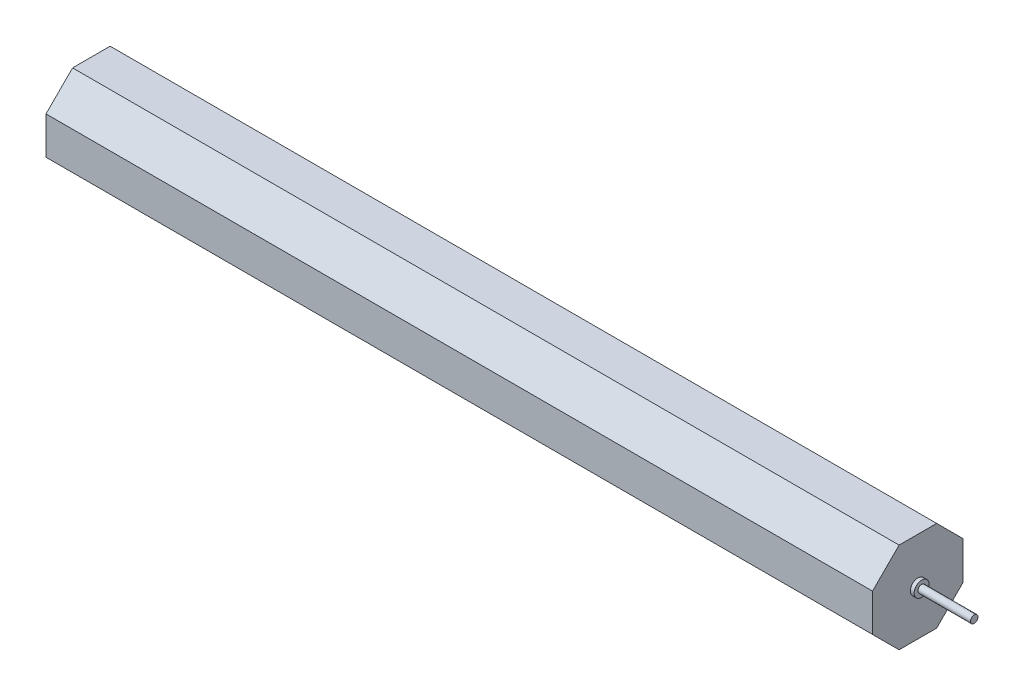
from build123d import *

# Parameters (mm, degrees)
EXTRUDE_1_DEPTH = 220
SKETCH_4_R      = 1
EXTRUDE_2_DEPTH = 15
SKETCH_5_R      = 2
EXTRUDE_3_DEPTH = 1
EXTRUDE_START   = 5
SKETCH_6_R      = 1
EXTRUDE_4_DEPTH = 5
EXTRUDE_START_2 = 1
SKETCH_7_R      = 2
EXTRUDE_5_DEPTH = 1


with BuildPart() as part:
    # 草图1 → 凸台-拉伸1 (new body)
    with BuildSketch(Plane(origin=(0, 0, 0), x_dir=(0, 0, -1), z_dir=(1, 0, 0))):
        Polygon((12.071067812, -5), (12.071067812, 5), (5, 12.071067812), (-5, 12.071067812), (-12.071067812, 5), (-12.071067812, -5), (-5, -12.071067812), (5, -12.071067812), align=None)
    extrude(amount=EXTRUDE_1_DEPTH)

    # 草图4 → 凸台-拉伸2 (add)
    with BuildSketch(Plane(origin=(220, 0, 0), x_dir=(0, 0, -1), z_dir=(1, 0, 0))):
        Circle(SKETCH_4_R)
    extrude(amount=EXTRUDE_2_DEPTH)

    # 草图5 → 凸台-拉伸3 (add)
    with BuildSketch(Plane(origin=(220, 0, 0), x_dir=(0, 0, -1), z_dir=(1, 0, 0))):
        Circle(SKETCH_5_R)
    extrude(amount=EXTRUDE_3_DEPTH)

    # 草图6 → 凸台-拉伸4 (add)
    with BuildSketch(Plane.ZY.offset(EXTRUDE_START)):
        with Locations(Location((0, 0, 0), (0, 0, 180))):
            Circle(SKETCH_6_R)
    extrude(amount=-EXTRUDE_4_DEPTH)

    # 草图7 → 凸台-拉伸5 (add)
    with BuildSketch(Plane.ZY.offset(EXTRUDE_START_2)):
        with Locations(Location((0, 0, 0), (0, 0, 180))):
            Circle(SKETCH_7_R)
    extrude(amount=-EXTRUDE_5_DEPTH)


solid = part.part
